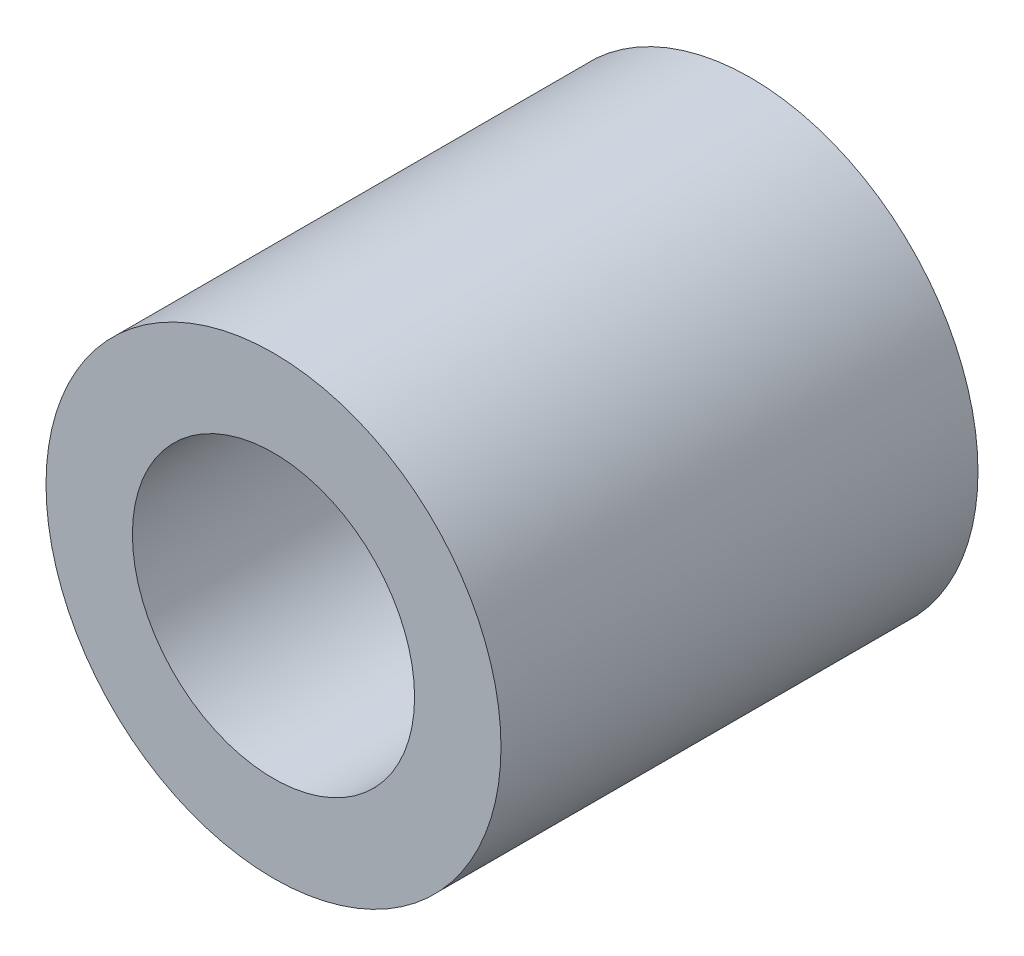
from build123d import *

# Parameters (mm, degrees)
SKETCH1_R           = 47.691663128
SKETCH1_R_2         = 29.578370311
BOSS_EXTRUDE1_DEPTH = 100


with BuildPart() as part:
    # Sketch1 → Boss-Extrude1 (new body)
    with BuildSketch(Plane.XY):
        Circle(SKETCH1_R)
        Circle(SKETCH1_R_2, mode=Mode.SUBTRACT)
    extrude(amount=BOSS_EXTRUDE1_DEPTH)


solid = part.part
